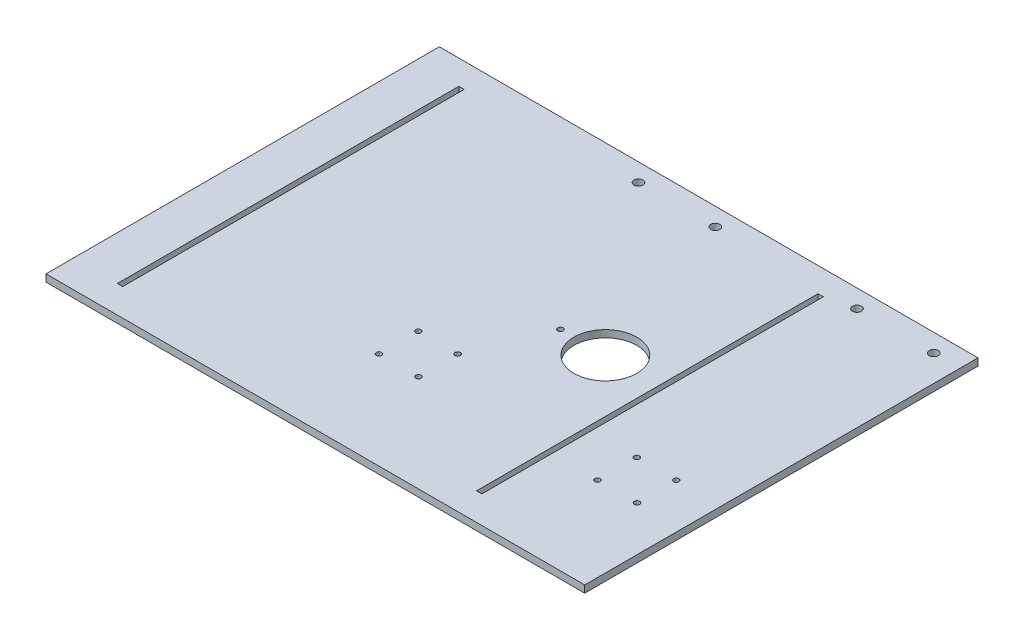
from build123d import *

# Parameters (mm, degrees)
SKETCH1_W               = 300
SKETCH1_H               = 219
SKETCH1_W_2             = 3
SKETCH1_H_2             = 190.1710485
BOSS_EXTRUDE1_DEPTH     = 4
SKETCH2_R               = 17.5
CUT_EXTRUDE2_DEPTH      = 186.758579883
CUT_EXTRUDE3_DEPTH      = 186.758579883
CUT_EXTRUDE3_DEPTH_BACK = 186.758579883
SKETCH3_R               = 1.5
CUT_EXTRUDE4_DEPTH      = 186.758579883
CUT_EXTRUDE4_DEPTH_BACK = 186.758579883
SKETCH4_R               = 1.5
CUT_EXTRUDE5_DEPTH      = 186.758579883
CUT_EXTRUDE5_DEPTH_BACK = 186.758579883
SKETCH5_R               = 2.5
CUT_EXTRUDE6_DEPTH      = 186.758579883
CUT_EXTRUDE6_DEPTH_BACK = 186.758579883
SKETCH6_R               = 2.5
CUT_EXTRUDE7_DEPTH      = 186.758579883
CUT_EXTRUDE7_DEPTH_BACK = 186.758579883
SKETCH7_R               = 1.5


with BuildPart() as part:
    # Sketch1 → Boss-Extrude1 (new body)
    with BuildSketch(Plane(origin=(0, 0, 0), x_dir=(1, 0, 0), z_dir=(0, 1, 0))):
        Rectangle(SKETCH1_W, SKETCH1_H)
        with Locations((-124, 0.80041533)):
            Rectangle(SKETCH1_W_2, SKETCH1_H_2, mode=Mode.SUBTRACT)
        with Locations((76, 0.80041533)):
            Rectangle(SKETCH1_W_2, SKETCH1_H_2, mode=Mode.SUBTRACT)
    extrude(amount=BOSS_EXTRUDE1_DEPTH)

    # Sketch2 → Cut-Extrude2 (cut, through all)
    with BuildSketch(Plane(origin=(0, 0, 0), x_dir=(-1, 0, 0), z_dir=(0, -1, 0))):
        with Locations(Location((-45, 7, 0), (0, 0, 90))):
            Circle(SKETCH2_R)
    extrude(amount=-CUT_EXTRUDE2_DEPTH, mode=Mode.SUBTRACT)

    # Sketch3 → Cut-Extrude3 (cut, two sides: drawn at the far end of the back side and taken through both)
    with BuildSketch(Plane(origin=(0, 0, 0), x_dir=(-1, 0, 0), z_dir=(0, -1, 0)).offset(-CUT_EXTRUDE3_DEPTH_BACK)):
        with Locations(Location((-125, -55.39, 0), (0, 0, 90))):
            Circle(SKETCH3_R)
        with Locations(Location((-125, -33.54, 0), (0, 0, 90))):
            Circle(SKETCH3_R)
        with Locations(Location((-103, -33.54, 0), (0, 0, 90))):
            Circle(SKETCH3_R)
        with Locations(Location((-103, -55.39, 0), (0, 0, 90))):
            Circle(SKETCH3_R)
    extrude(amount=CUT_EXTRUDE3_DEPTH + CUT_EXTRUDE3_DEPTH_BACK, mode=Mode.SUBTRACT)

    # Sketch4 → Cut-Extrude4 (cut, two sides: drawn at the far end of the back side and taken through both)
    with BuildSketch(Plane(origin=(0, 0, 0), x_dir=(-1, 0, 0), z_dir=(0, -1, 0)).offset(-CUT_EXTRUDE4_DEPTH_BACK)):
        with Locations(Location((-3.32, -55.39, 0), (0, 0, 90))):
            Circle(SKETCH4_R)
        with Locations(Location((-3.32, -33.54, 0), (0, 0, 90))):
            Circle(SKETCH4_R)
        with Locations(Location((18.68, -33.54, 0), (0, 0, 90))):
            Circle(SKETCH4_R)
        with Locations(Location((18.68, -55.39, 0), (0, 0, 90))):
            Circle(SKETCH4_R)
    extrude(amount=CUT_EXTRUDE4_DEPTH + CUT_EXTRUDE4_DEPTH_BACK, mode=Mode.SUBTRACT)

    # Sketch5 → Cut-Extrude5 (cut, two sides: drawn at the far end of the back side and taken through both)
    with BuildSketch(Plane(origin=(0, 0, 0), x_dir=(-1, 0, 0), z_dir=(0, -1, 0)).offset(-CUT_EXTRUDE5_DEPTH_BACK)):
        with Locations(Location((-135.39, 99.5, 0), (0, 0, 90))):
            Circle(SKETCH5_R)
        with Locations(Location((-92.61, 99.5, 0), (0, 0, 90))):
            Circle(SKETCH5_R)
    extrude(amount=CUT_EXTRUDE5_DEPTH + CUT_EXTRUDE5_DEPTH_BACK, mode=Mode.SUBTRACT)

    # Sketch6 → Cut-Extrude6 (cut, two sides: drawn at the far end of the back side and taken through both)
    with BuildSketch(Plane.XZ.offset(-CUT_EXTRUDE6_DEPTH_BACK)):
        with Locations(Location((13.71, -99.5, 0), (0, 0, 270))):
            Circle(SKETCH6_R)
        with Locations(Location((-29.07, -99.5, 0), (0, 0, 270))):
            Circle(SKETCH6_R)
    extrude(amount=CUT_EXTRUDE6_DEPTH + CUT_EXTRUDE6_DEPTH_BACK, mode=Mode.SUBTRACT)

    # Sketch7 → Cut-Extrude7 (cut, two sides: drawn at the far end of the back side and taken through both)
    with BuildSketch(Plane(origin=(0, 4, 0), x_dir=(1, 0, 0), z_dir=(0, 1, 0)).offset(-CUT_EXTRUDE7_DEPTH_BACK)):
        with Locations(Location((20, 7, 0), (0, 0, 270))):
            Circle(SKETCH7_R)
    extrude(amount=CUT_EXTRUDE7_DEPTH + CUT_EXTRUDE7_DEPTH_BACK, mode=Mode.SUBTRACT)


solid = part.part
